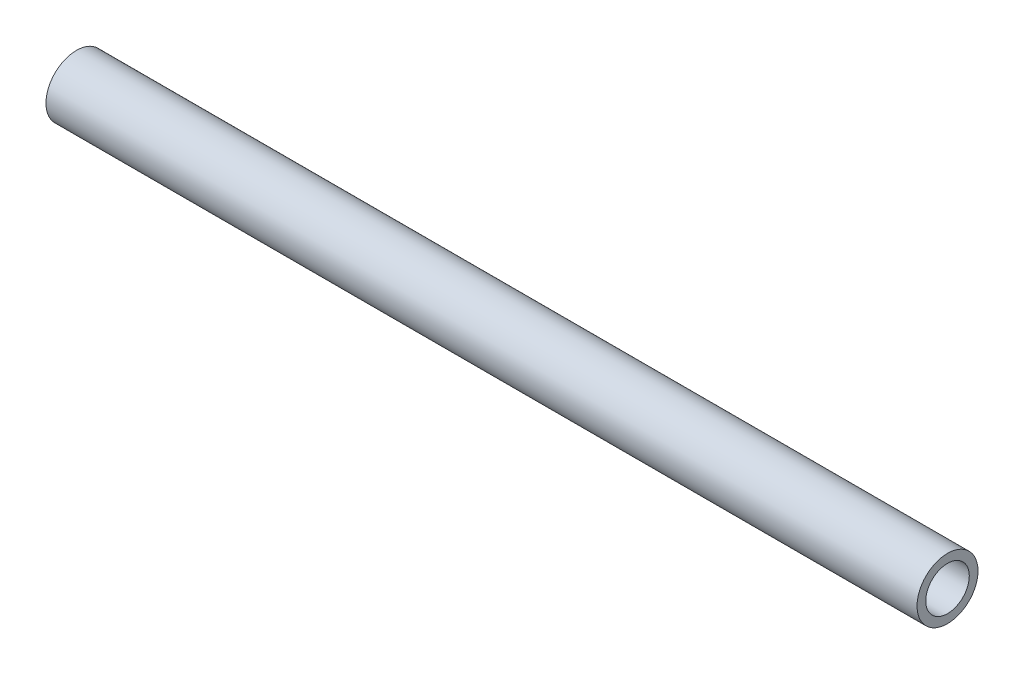
from build123d import *

# Parameters (mm, degrees)
SKETCH1_R           = 4.445
SKETCH1_R_2         = 3.175
BOSS_EXTRUDE1_DEPTH = 63.5


with BuildPart() as part:
    # Sketch1 → Boss-Extrude1 (new, symmetric)
    with BuildSketch(Plane(origin=(0, 0, 0), x_dir=(0, 0, -1), z_dir=(1, 0, 0))):
        Circle(SKETCH1_R)
        Circle(SKETCH1_R_2, mode=Mode.SUBTRACT)
    extrude(amount=BOSS_EXTRUDE1_DEPTH, both=True)


solid = part.part
